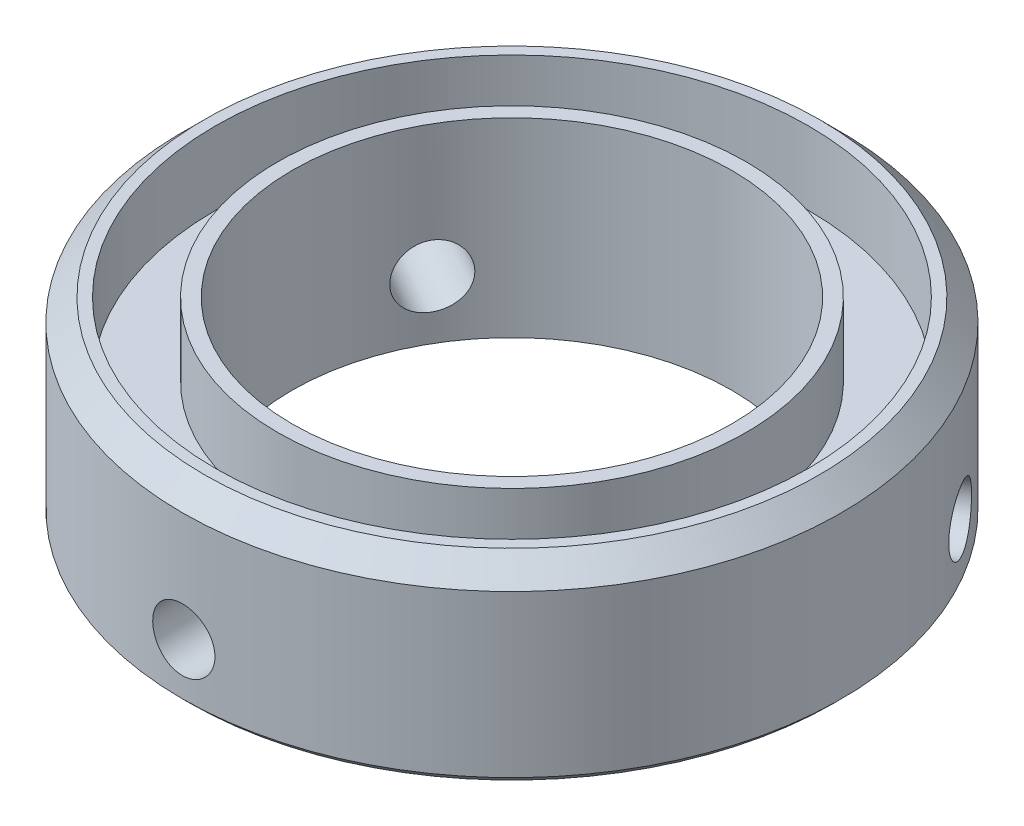
from build123d import *

# Parameters (mm, degrees)
SCHIZZO1_R                  = 45
SCHIZZO1_R_2                = 30
ESTRUSIONE1_DEPTH           = 26
SCHIZZO2_R                  = 40.5
SCHIZZO2_R_2                = 32
ESTRUSIONE2_DEPTH           = 10
RIPETIZIONECIRCOLARE1_COUNT = 3
SMUSSO1_SIZE                = 3
SMUSSO2_SIZE                = 1


with BuildPart() as part:
    # Schizzo1 → Estrusione1 (new body)
    with BuildSketch(Plane(origin=(0, 0, 0), x_dir=(1, 0, 0), z_dir=(0, 1, 0))):
        with Locations(Location((0, 0, 0), (0, 0, 90))):
            Circle(SCHIZZO1_R)
        with Locations(Location((0, 0, 0), (0, 0, 90))):
            Circle(SCHIZZO1_R_2, mode=Mode.SUBTRACT)
    extrude(amount=ESTRUSIONE1_DEPTH)

    # Schizzo2 → Estrusione2 (cut)
    with BuildSketch(Plane(origin=(0, 26, 0), x_dir=(1, 0, 0), z_dir=(0, 1, 0))):
        with Locations(Location((0, 0, 0), (0, 0, 270))):
            Circle(SCHIZZO2_R)
        with Locations(Location((0, 0, 0), (0, 0, 270))):
            Circle(SCHIZZO2_R_2, mode=Mode.SUBTRACT)
    extrude(amount=-ESTRUSIONE2_DEPTH, mode=Mode.SUBTRACT)

    # Schizzo3 → Foro filettato M10-1 (revolve, cut)
    with BuildSketch(Plane(origin=(0, 8, 45), x_dir=(0, -1, 0), z_dir=(1, 0, 0))):
        Polygon((0, 0), (0, 50.053657631), (4.25, 47.5), (4.25, 0), align=None)
    foro_filettato_m10_1 = revolve(axis=Axis((0, 8, 51.35), (0, 0, -1)), mode=Mode.SUBTRACT)

    # RipetizioneCircolare1: Foro filettato M10-1 ×3 about axis
    ripetizionecircolare1_axis = Axis((0, 26, 0), (0, -1, 0))
    for i in range(1, RIPETIZIONECIRCOLARE1_COUNT):
        add(foro_filettato_m10_1.rotate(ripetizionecircolare1_axis, i * 360 / RIPETIZIONECIRCOLARE1_COUNT), mode=Mode.SUBTRACT)

    # Smusso1
    smusso1_edges = [part.edges().sort_by_distance(p)[0] for p in [
        (0, 26, 45),
    ]]
    chamfer(smusso1_edges, length=SMUSSO1_SIZE)

    # Smusso2
    smusso2_edges = [part.edges().sort_by_distance(p)[0] for p in [
        (0, 0, 45),
    ]]
    chamfer(smusso2_edges, length=SMUSSO2_SIZE)


solid = part.part
